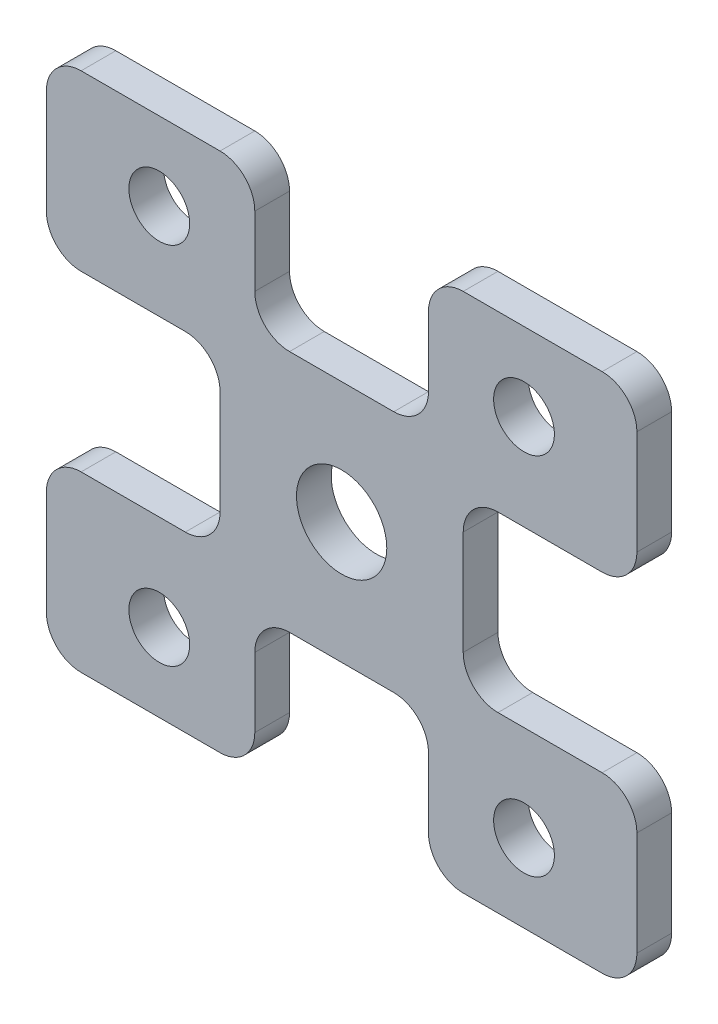
from build123d import *

# Parameters (mm, degrees)
SKETCH_1_W          = 34
SKETCH_1_H          = 30
SKETCH_1_R          = 2.6
EXTRUDE_1_DEPTH     = 2
SKETCH_2_R          = 1.75
CUT_EXTRUDE_1_DEPTH = 2
SKETCH_3_W          = 10
SKETCH_3_H          = 10
CUT_EXTRUDE_2_DEPTH = 2
FILLET_1_R          = 2


with BuildPart() as part:
    # 草图1 → 凸台-拉伸1 (new body)
    with BuildSketch(Plane.XY):
        Rectangle(SKETCH_1_W, SKETCH_1_H)
        Circle(SKETCH_1_R, mode=Mode.SUBTRACT)
    extrude(amount=EXTRUDE_1_DEPTH)

    # 草图2 → 切除-拉伸1 (cut)
    with BuildSketch(Plane(origin=(0, 0, 0), x_dir=(-1, 0, 0), z_dir=(0, 0, -1))):
        with Locations((10.5, -10.5)):
            Circle(SKETCH_2_R)
        with Locations((-10.5, -10.5)):
            Circle(SKETCH_2_R)
        with Locations((-10.5, 10.5)):
            Circle(SKETCH_2_R)
        with Locations((10.5, 10.5)):
            Circle(SKETCH_2_R)
    extrude(amount=-CUT_EXTRUDE_1_DEPTH, mode=Mode.SUBTRACT)

    # 草图3 → 切除-拉伸2 (cut)
    with BuildSketch(Plane.XY.offset(2)):
        with Locations((-12, 0)):
            Rectangle(SKETCH_3_W, SKETCH_3_H)
        with Locations((0, 12)):
            Rectangle(SKETCH_3_W, SKETCH_3_H)
        with Locations((12, 0)):
            Rectangle(SKETCH_3_W, SKETCH_3_H)
        with Locations((0, -12)):
            Rectangle(SKETCH_3_W, SKETCH_3_H)
    extrude(amount=-CUT_EXTRUDE_2_DEPTH, mode=Mode.SUBTRACT)

    # 圆角1
    fillet_1_edges = [part.edges().sort_by_distance(p)[0] for p in [
        (-17, -5, 1),
        (-17, 5, 1),
        (-7, 5, 1),
        (-7, -5, 1),
        (-5, 15, 1),
        (5, 15, 1),
        (-5, 7, 1),
        (5, 7, 1),
        (17, -5, 1),
        (7, -5, 1),
        (7, 5, 1),
        (17, 5, 1),
        (17, -15, 1),
        (-17, -15, 1),
        (-17, 15, 1),
        (17, 15, 1),
        (5, -15, 1),
        (-5, -15, 1),
        (5, -7, 1),
        (-5, -7, 1),
    ]]
    fillet(fillet_1_edges, radius=FILLET_1_R)


solid = part.part
